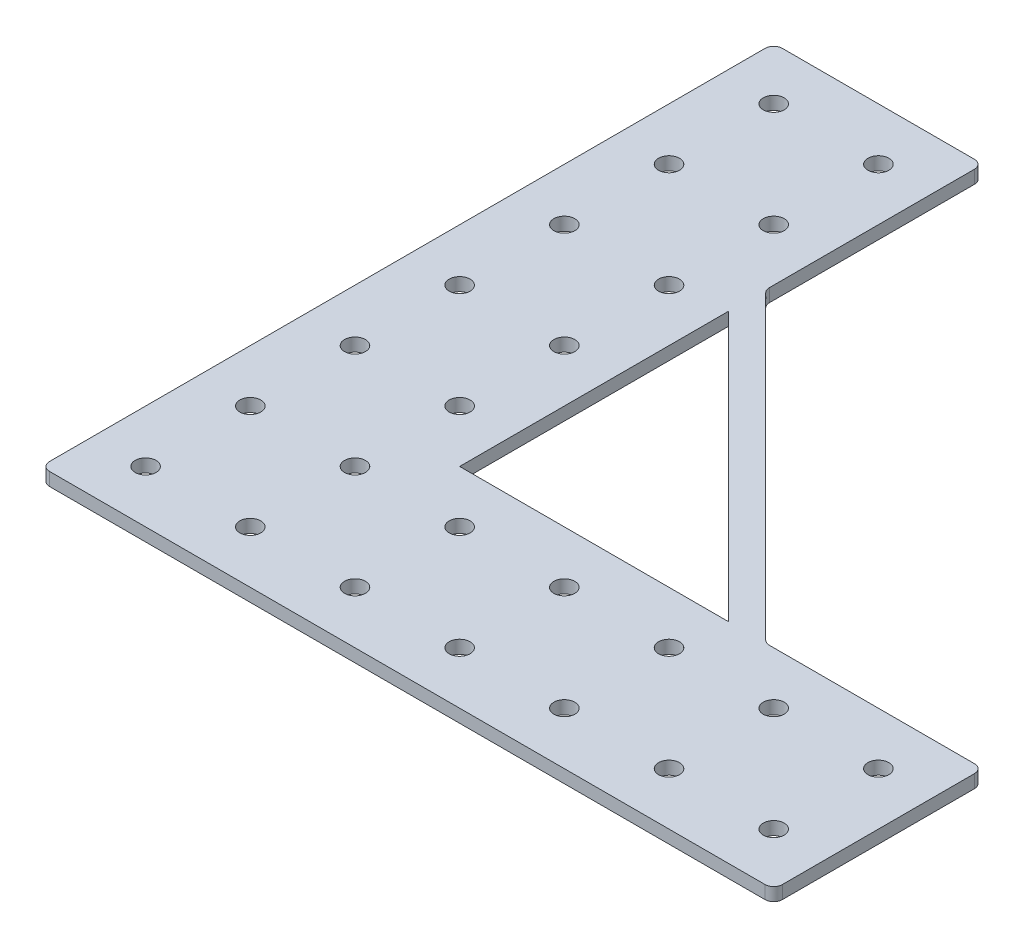
from build123d import *

# Parameters (mm, degrees)
SKETCH1_R           = 2.54
BOSS_EXTRUDE1_DEPTH = 3.175


with BuildPart() as part:
    # Sketch1 → Boss-Extrude1 (new body)
    with BuildSketch(Plane(origin=(0, 0, 0), x_dir=(1, 0, 0), z_dir=(0, 1, 0))):
        with BuildLine():
            Line((-92.728830313, 61.050098366), (-92.728830313, -112.561465747))
            ThreePointArc((-92.728830313, -112.561465747), (-92.115448079, -114.042301456), (-90.63461237, -114.65568369))
            Line((-90.63461237, -114.65568369), (82.976951744, -114.65568369))
            ThreePointArc((82.976951744, -114.65568369), (84.457787453, -114.042301456), (85.071169687, -112.561465747))
            Line((85.071169687, -112.561465747), (85.071169687, -65.949901634))
            ThreePointArc((85.071169687, -65.949901634), (84.457787453, -64.469065925), (82.976951744, -63.85568369))
            Line((82.976951744, -63.85568369), (33.202051993, -63.85568369))
            ThreePointArc((33.202051993, -63.85568369), (32.400629482, -63.696270841), (31.721216284, -63.242301456))
            Line((31.721216284, -63.242301456), (-41.315448079, 9.794362906))
            ThreePointArc((-41.315448079, 9.794362906), (-41.769417464, 10.473776105), (-41.928830313, 11.275198615))
            Line((-41.928830313, 11.275198615), (-41.928830313, 61.050098366))
            ThreePointArc((-41.928830313, 61.050098366), (-42.542212547, 62.530934075), (-44.023048256, 63.14431631))
            Line((-44.023048256, 63.14431631), (-90.63461237, 63.14431631))
            ThreePointArc((-90.63461237, 63.14431631), (-92.115448079, 62.530934075), (-92.728830313, 61.050098366))
        make_face()
        with Locations(Location((-80.028830313, 50.44431631, 0), (0, 0, 270))):
            Circle(SKETCH1_R, mode=Mode.SUBTRACT)
        with Locations(Location((-54.628830313, 50.44431631, 0), (0, 0, 270))):
            Circle(SKETCH1_R, mode=Mode.SUBTRACT)
        with Locations(Location((-54.628830313, 25.04431631, 0), (0, 0, 270))):
            Circle(SKETCH1_R, mode=Mode.SUBTRACT)
        with Locations(Location((-54.628830313, -0.35568369, 0), (0, 0, 270))):
            Circle(SKETCH1_R, mode=Mode.SUBTRACT)
        with Locations(Location((-54.628830313, -25.75568369, 0), (0, 0, 270))):
            Circle(SKETCH1_R, mode=Mode.SUBTRACT)
        with Locations(Location((-54.628830313, -51.15568369, 0), (0, 0, 270))):
            Circle(SKETCH1_R, mode=Mode.SUBTRACT)
        with Locations(Location((-80.028830313, 25.04431631, 0), (0, 0, 270))):
            Circle(SKETCH1_R, mode=Mode.SUBTRACT)
        with Locations(Location((-80.028830313, -0.35568369, 0), (0, 0, 270))):
            Circle(SKETCH1_R, mode=Mode.SUBTRACT)
        with Locations(Location((-80.028830313, -25.75568369, 0), (0, 0, 270))):
            Circle(SKETCH1_R, mode=Mode.SUBTRACT)
        with Locations(Location((-80.028830313, -51.15568369, 0), (0, 0, 270))):
            Circle(SKETCH1_R, mode=Mode.SUBTRACT)
        with Locations(Location((-80.028830313, -76.55568369, 0), (0, 0, 270))):
            Circle(SKETCH1_R, mode=Mode.SUBTRACT)
        with Locations(Location((-54.628830313, -76.55568369, 0), (0, 0, 270))):
            Circle(SKETCH1_R, mode=Mode.SUBTRACT)
        with Locations(Location((-80.028830313, -101.95568369, 0), (0, 0, 270))):
            Circle(SKETCH1_R, mode=Mode.SUBTRACT)
        with Locations(Location((-54.628830313, -101.95568369, 0), (0, 0, 270))):
            Circle(SKETCH1_R, mode=Mode.SUBTRACT)
        with Locations(Location((-29.228830313, -101.95568369, 0), (0, 0, 270))):
            Circle(SKETCH1_R, mode=Mode.SUBTRACT)
        with Locations(Location((-3.828830313, -101.95568369, 0), (0, 0, 270))):
            Circle(SKETCH1_R, mode=Mode.SUBTRACT)
        with Locations(Location((21.571169687, -101.95568369, 0), (0, 0, 270))):
            Circle(SKETCH1_R, mode=Mode.SUBTRACT)
        with Locations(Location((46.971169687, -101.95568369, 0), (0, 0, 270))):
            Circle(SKETCH1_R, mode=Mode.SUBTRACT)
        with Locations(Location((72.371169687, -101.95568369, 0), (0, 0, 270))):
            Circle(SKETCH1_R, mode=Mode.SUBTRACT)
        with Locations(Location((-3.828830313, -76.55568369, 0), (0, 0, 270))):
            Circle(SKETCH1_R, mode=Mode.SUBTRACT)
        with Locations(Location((21.571169687, -76.55568369, 0), (0, 0, 270))):
            Circle(SKETCH1_R, mode=Mode.SUBTRACT)
        with Locations(Location((46.971169687, -76.55568369, 0), (0, 0, 270))):
            Circle(SKETCH1_R, mode=Mode.SUBTRACT)
        with Locations(Location((72.371169687, -76.55568369, 0), (0, 0, 270))):
            Circle(SKETCH1_R, mode=Mode.SUBTRACT)
        with Locations(Location((-29.228830313, -76.55568369, 0), (0, 0, 270))):
            Circle(SKETCH1_R, mode=Mode.SUBTRACT)
        Polygon((-41.928830313, 1.42748902), (-41.928830313, -63.85568369), (23.354342397, -63.85568369), align=None, mode=Mode.SUBTRACT)
    extrude(amount=BOSS_EXTRUDE1_DEPTH)


solid = part.part
